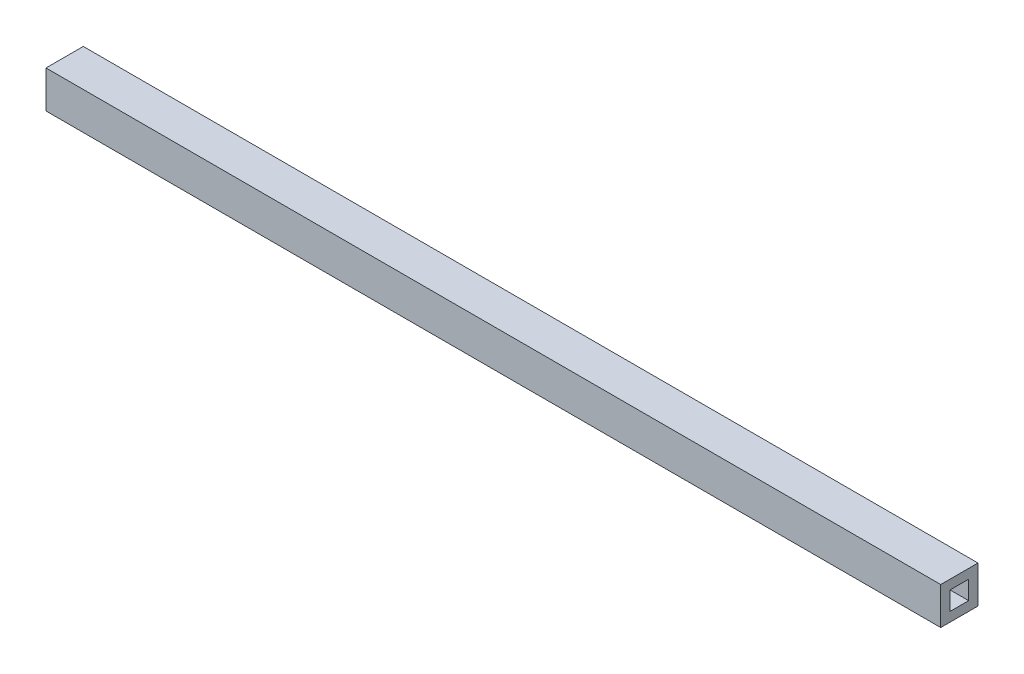
from build123d import *

# Parameters (mm, degrees)
SKETCH1_W           = 304.8
SKETCH1_H           = 12.7
BOSS_EXTRUDE1_DEPTH = 12.7
SKETCH2_W           = 6.35
SKETCH2_H           = 6.35
CUT_EXTRUDE1_DEPTH  = 306.130549929


with BuildPart() as part:
    # Sketch1 → Boss-Extrude1 (new body)
    with BuildSketch(Plane.XY):
        Rectangle(SKETCH1_W, SKETCH1_H)
    extrude(amount=BOSS_EXTRUDE1_DEPTH)

    # Sketch2 → Cut-Extrude1 (cut, through all)
    with BuildSketch(Plane(origin=(152.4, 0, 0), x_dir=(0, 0, -1), z_dir=(1, 0, 0))):
        with Locations((-6.35, 0)):
            Rectangle(SKETCH2_W, SKETCH2_H)
    extrude(amount=-CUT_EXTRUDE1_DEPTH, mode=Mode.SUBTRACT)


solid = part.part
